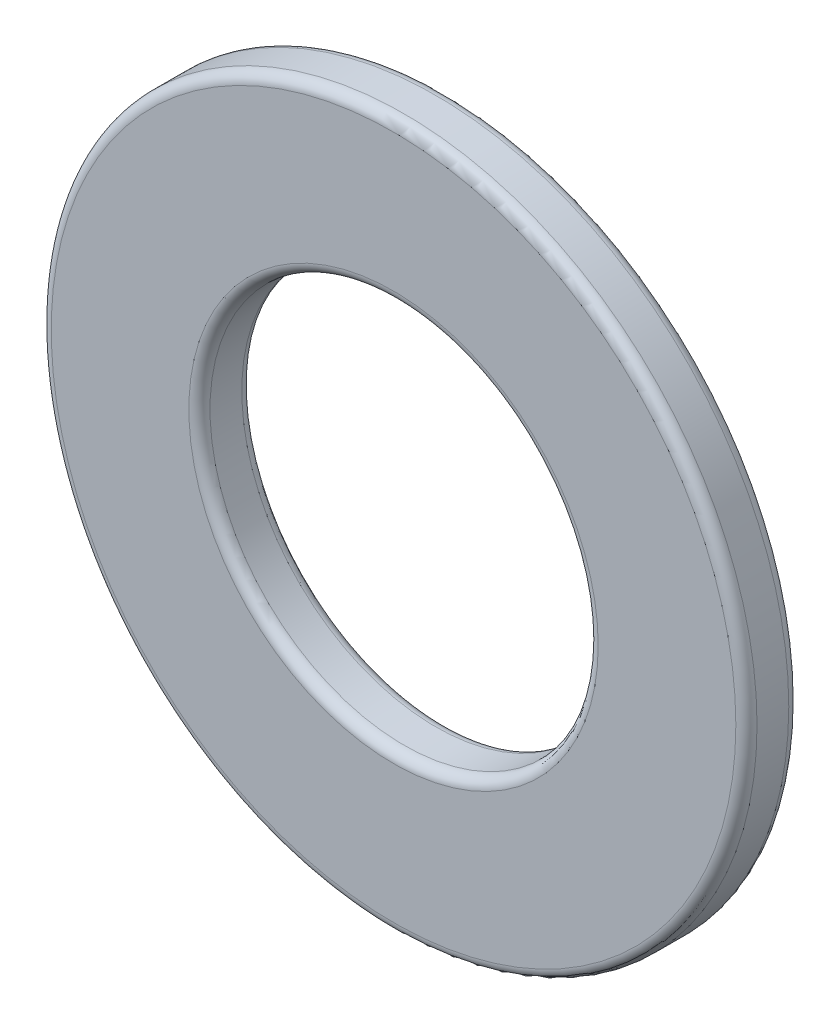
from build123d import *

# Parameters (mm, degrees)
BOSS_EXTRUDE1_START = 0.15
SKETCH3_R           = 2
SKETCH3_R_2         = 1.1
BOSS_EXTRUDE1_DEPTH = 0.3
FILLET1_R           = 0.06


with BuildPart() as part:
    # Sketch3 → Boss-Extrude1 (new body)
    with BuildSketch(Plane.XY.offset(BOSS_EXTRUDE1_START)):
        Circle(SKETCH3_R)
        Circle(SKETCH3_R_2, mode=Mode.SUBTRACT)
    extrude(amount=-BOSS_EXTRUDE1_DEPTH)

    # Fillet1
    fillet1_edges = [part.edges().sort_by_distance(p)[0] for p in [
        (-2, 0, 0.15),
        (-2, 0, -0.15),
        (-1.1, 0, -0.15),
        (-1.1, 0, 0.15),
    ]]
    fillet(fillet1_edges, radius=FILLET1_R)


solid = part.part
